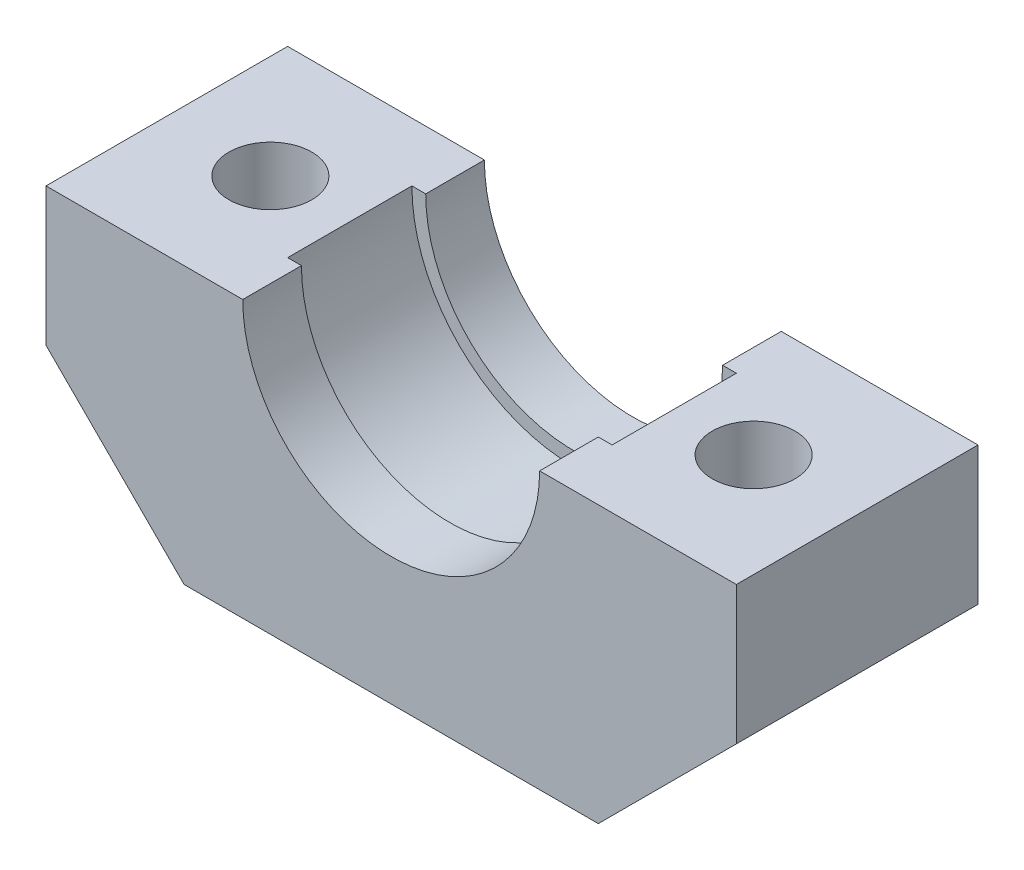
from build123d import *

# Parameters (mm, degrees)
EXTRUDE_1_DEPTH         = 17.5
SKETCH_3_R              = 23.5
CUT_EXTRUDE_1_DEPTH     = 9
HOLE_WIZARD_M14_1_D     = 12
HOLE_WIZARD_M14_1_DEPTH = 20
HOLE_WIZARD_M14_1_TIP   = 3.605163714
HOLE_WIZARD_M6_1_D      = 5
HOLE_WIZARD_M6_1_DEPTH  = 15
HOLE_WIZARD_M6_1_TIP    = 1.502151548
SKETCH_8_R              = 2.5
CUT_EXTRUDE_2_DEPTH     = 77.871280236


with BuildPart() as part:
    # 草图2 → 凸台-拉伸1 (new, symmetric)
    with BuildSketch(Plane.XY):
        with BuildLine():
            Line((0, 0), (0, -20))
            Line((0, -20), (20, -40))
            Line((20, -40), (80, -40))
            Line((80, -40), (100, -20))
            Line((100, -20), (100, 0))
            Line((100, 0), (71.5, 0))
            ThreePointArc((71.5, 0), (50, -21.500002185), (28.5, 0))
            Line((28.5, 0), (0, 0))
        make_face()
    extrude(amount=EXTRUDE_1_DEPTH, both=True)

    # 草图3 → 切除-拉伸1 (cut, symmetric)
    with BuildSketch(Plane.XY):
        with Locations((50, -2.185e-06)):
            Circle(SKETCH_3_R)
    extrude(amount=CUT_EXTRUDE_1_DEPTH, both=True, mode=Mode.SUBTRACT)

    # M14 螺纹孔1
    with Locations(Plane(origin=(0, 0, 0), x_dir=(1, 0, 0), z_dir=(0, 1, 0))):
        with Locations((15, 0), (85, 0)):
            Hole(HOLE_WIZARD_M14_1_D / 2, depth=HOLE_WIZARD_M14_1_DEPTH)
            with Locations((0, 0, -(HOLE_WIZARD_M14_1_DEPTH + HOLE_WIZARD_M14_1_TIP / 2))):  # 118° drill point
                Cone(0, HOLE_WIZARD_M14_1_D / 2, HOLE_WIZARD_M14_1_TIP, mode=Mode.SUBTRACT)

    # M6 螺纹孔1
    with Locations(Plane(origin=(60, -60, 0), x_dir=(-0.7071067811865476, -0.7071067811865476, 0), z_dir=(0.7071067811865476, -0.7071067811865476, 0))):
        with Locations((-33.284271247, 0)):
            Hole(HOLE_WIZARD_M6_1_D / 2, depth=HOLE_WIZARD_M6_1_DEPTH)
            with Locations((0, 0, -(HOLE_WIZARD_M6_1_DEPTH + HOLE_WIZARD_M6_1_TIP / 2))):  # 118° drill point
                Cone(0, HOLE_WIZARD_M6_1_D / 2, HOLE_WIZARD_M6_1_TIP, mode=Mode.SUBTRACT)

    # 草图8 → 切除-拉伸2 (cut, through all)
    with BuildSketch(Plane(origin=(52.928932188, -52.928932188, 0), x_dir=(-0.7071067811865476, -0.7071067811865476, 0), z_dir=(0.7071067811865476, -0.7071067811865476, 0))):
        with Locations(Location((-33.284271247, 0, 0), (0, 0, 180))):
            Circle(SKETCH_8_R)
    extrude(amount=-CUT_EXTRUDE_2_DEPTH, mode=Mode.SUBTRACT)


solid = part.part
